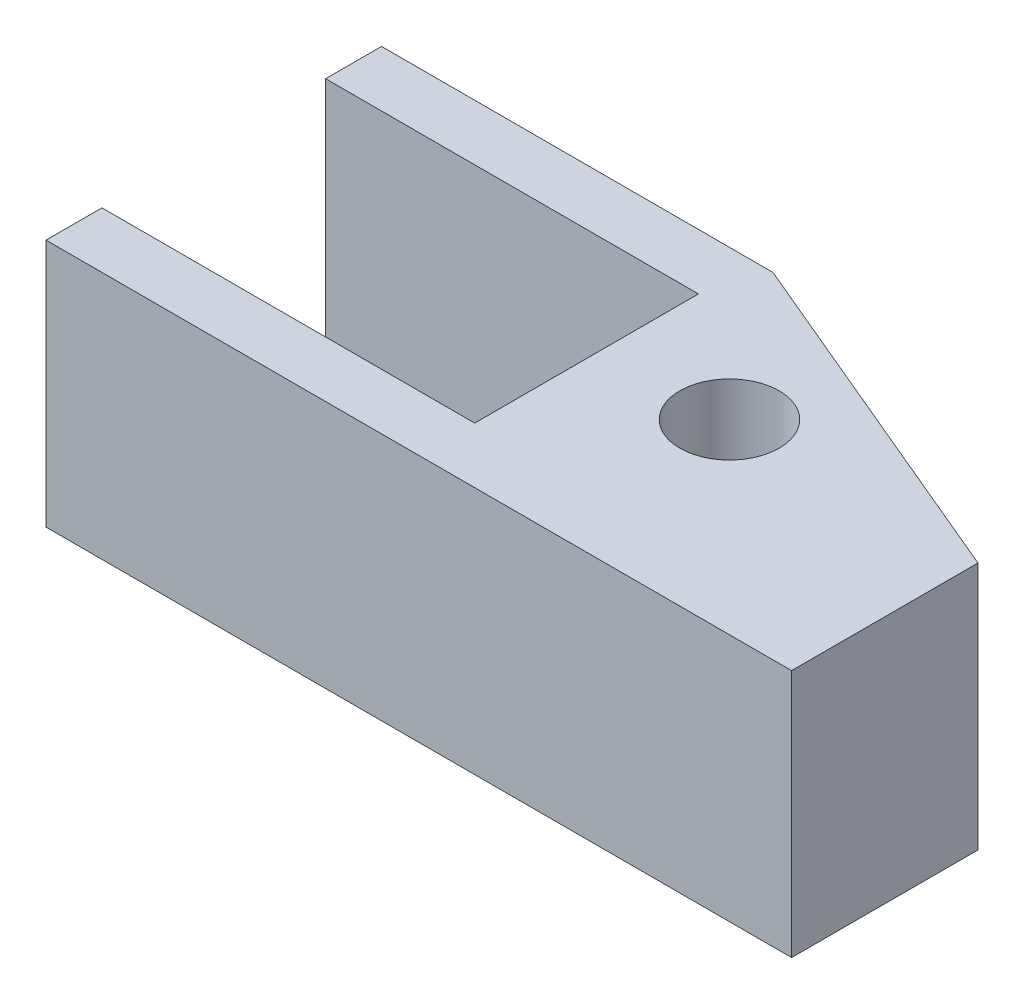
from build123d import *

# Parameters (mm, degrees)
SKETCH_1_R      = 4
EXTRUDE_1_DEPTH = 20


with BuildPart() as part:
    # 草图1 → 凸台-拉伸1 (new body)
    with BuildSketch(Plane(origin=(0, 0, 0), x_dir=(1, 0, 0), z_dir=(0, 1, 0))):
        Polygon((-30, 13.5), (1.5, 13.5), (30, 1.5), (30, -13.5), (-30, -13.5), (-30, -9), (0, -9), (0, 9), (-30, 9), align=None)
        with Locations(Location((10, 1.5, 0), (0, 0, 270))):
            Circle(SKETCH_1_R, mode=Mode.SUBTRACT)
    extrude(amount=EXTRUDE_1_DEPTH)


solid = part.part
